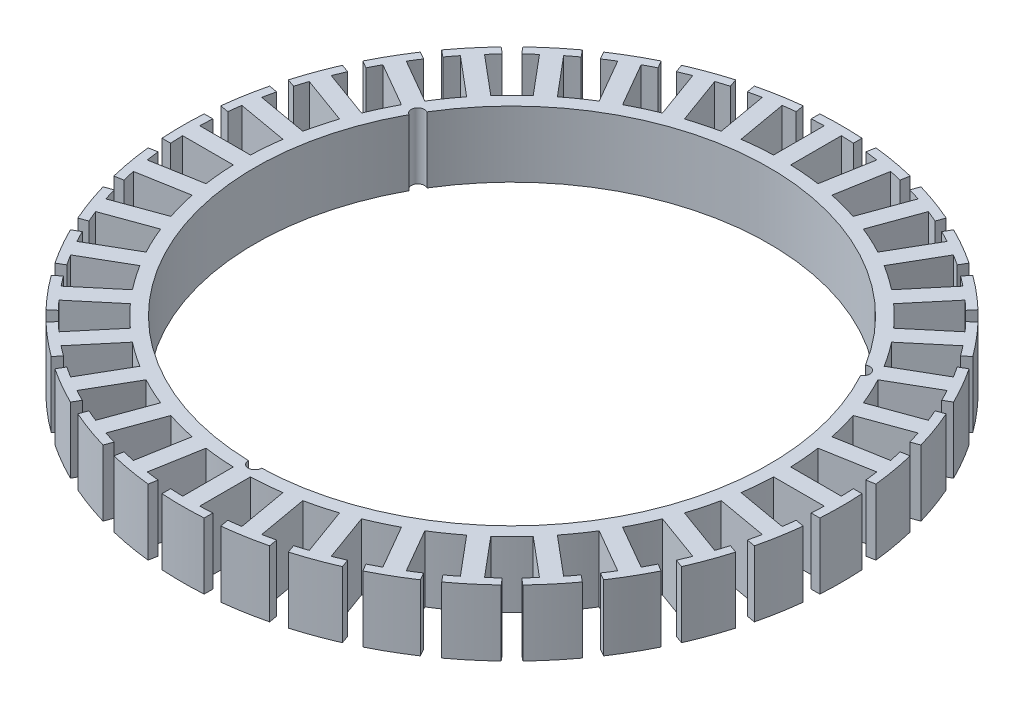
from build123d import *

# Parameters (mm, degrees)
SALIENTE_EXTRUIR3_DEPTH = 10
CROQUIS2_R              = 1
CORTAR_EXTRUIR1_DEPTH   = 10


with BuildPart() as part:
    # Croquis1 → Saliente-Extruir3 (new body)
    with BuildSketch(Plane(origin=(0, 0, 0), x_dir=(1, 0, 0), z_dir=(0, 1, 0))):
        with BuildLine():
            Line((-1.3, -40.979385061), (-1.3, -48.666202405))
            ThreePointArc((-1.3, -48.666202405), (-2.250429426, -48.631520889), (-3.2, -48.578279679))
            Line((-3.2, -48.578279679), (-3.2, -49.897494927))
            ThreePointArc((-3.2, -49.897494927), (0, -50), (3.2, -49.897494927))
            Line((3.2, -49.897494927), (3.2, -48.578279679))
            ThreePointArc((3.2, -48.578279679), (2.250429426, -48.631520889), (1.3, -48.666202405))
            Line((1.3, -48.666202405), (1.3, -40.979385061))
            ThreePointArc((1.3, -40.979385061), (2.437633052, -40.927471765), (3.573385453, -40.843982622))
            ThreePointArc((3.573385453, -40.843982622), (4.70638096, -40.728982043), (5.835745459, -40.582558753))
            Line((5.835745459, -40.582558753), (7.170547283, -48.15259607))
            ThreePointArc((7.170547283, -48.15259607), (6.228534633, -48.283481781), (5.284144931, -48.395940624))
            Line((5.284144931, -48.395940624), (5.513224255, -49.695114029))
            ThreePointArc((5.513224255, -49.695114029), (8.682408883, -49.240387651), (11.815993874, -48.583765692))
            Line((11.815993874, -48.583765692), (11.58691455, -47.284592287))
            ThreePointArc((11.58691455, -47.284592287), (10.661015326, -47.501915843), (9.731047441, -47.701110808))
            Line((9.731047441, -47.701110808), (8.396245617, -40.131073491))
            ThreePointArc((8.396245617, -40.131073491), (9.507580817, -39.882400968), (10.611580849, -39.602958878))
            ThreePointArc((10.611580849, -39.602958878), (11.707393968, -39.292962811), (12.794174745, -38.952651933))
            Line((12.794174745, -38.952651933), (15.423221115, -46.175897468))
            ThreePointArc((15.423221115, -46.175897468), (14.518247819, -46.468373512), (13.607733792, -46.743115403))
            Line((13.607733792, -46.743115403), (14.05893198, -47.982772237))
            ThreePointArc((14.05893198, -47.982772237), (17.101007166, -46.984631039), (20.072964753, -45.79384332))
            Line((20.072964753, -45.79384332), (19.621766565, -44.554186486))
            ThreePointArc((19.621766565, -44.554186486), (18.74767167, -44.928989122), (17.866421929, -45.286645096))
            Line((17.866421929, -45.286645096), (15.237375559, -38.06339956))
            ThreePointArc((15.237375559, -38.06339956), (16.288645551, -37.625523599), (17.327348731, -37.158619269))
            ThreePointArc((17.327348731, -37.158619269), (18.352683734, -36.663046788), (19.363859506, -36.139188495))
            Line((19.363859506, -36.139188495), (23.207268178, -42.796167589))
            ThreePointArc((23.207268178, -42.796167589), (22.366831392, -43.241347227), (21.517858547, -43.670024274))
            Line((21.517858547, -43.670024274), (22.177466171, -44.812498192))
            ThreePointArc((22.177466171, -44.812498192), (25, -43.301270189), (27.720028756, -41.612498192))
            Line((27.720028756, -41.612498192), (27.060421132, -40.470024274))
            ThreePointArc((27.060421132, -40.470024274), (26.264689497, -40.990917801), (25.458934228, -41.496167589))
            Line((25.458934228, -41.496167589), (21.615525556, -34.839188495))
            ThreePointArc((21.615525556, -34.839188495), (22.574788031, -34.225413735), (23.51663389, -33.585233816))
            ThreePointArc((23.51663389, -33.585233816), (24.440336492, -32.91914264), (25.345183194, -32.227654101))
            Line((25.345183194, -32.227654101), (30.286174141, -38.116097813))
            ThreePointArc((30.286174141, -38.116097813), (29.535810111, -38.700454489), (28.77417406, -39.270041555))
            Line((28.77417406, -39.270041555), (29.622149276, -40.280619065))
            ThreePointArc((29.622149276, -40.280619065), (32.139380484, -38.302222156), (34.524833712, -36.166778363))
            Line((34.524833712, -36.166778363), (33.676858496, -35.156200853))
            ThreePointArc((33.676858496, -35.156200853), (32.983668024, -35.807358186), (32.277889693, -36.444850028))
            Line((32.277889693, -36.444850028), (27.336898746, -30.556406316))
            ThreePointArc((27.336898746, -30.556406316), (28.175007001, -29.785381994), (28.991378029, -28.991378029))
            ThreePointArc((28.991378029, -28.991378029), (29.785381994, -28.175007001), (30.556406316, -27.336898746))
            Line((30.556406316, -27.336898746), (36.444850028, -32.277889693))
            ThreePointArc((36.444850028, -32.277889693), (35.807358186, -32.983668024), (35.156200853, -33.676858496))
            Line((35.156200853, -33.676858496), (36.166778363, -34.524833712))
            ThreePointArc((36.166778363, -34.524833712), (38.302222156, -32.139380484), (40.280619065, -29.622149276))
            Line((40.280619065, -29.622149276), (39.270041555, -28.77417406))
            ThreePointArc((39.270041555, -28.77417406), (38.700454489, -29.535810111), (38.116097813, -30.286174141))
            Line((38.116097813, -30.286174141), (32.227654101, -25.345183194))
            ThreePointArc((32.227654101, -25.345183194), (32.91914264, -24.440336492), (33.585233816, -23.51663389))
            ThreePointArc((33.585233816, -23.51663389), (34.225413735, -22.574788031), (34.839188495, -21.615525556))
            Line((34.839188495, -21.615525556), (41.496167589, -25.458934228))
            ThreePointArc((41.496167589, -25.458934228), (40.990917801, -26.264689497), (40.470024274, -27.060421132))
            Line((40.470024274, -27.060421132), (41.612498192, -27.720028756))
            ThreePointArc((41.612498192, -27.720028756), (43.301270189, -25), (44.812498192, -22.177466171))
            Line((44.812498192, -22.177466171), (43.670024274, -21.517858547))
            ThreePointArc((43.670024274, -21.517858547), (43.241347227, -22.366831392), (42.796167589, -23.207268178))
            Line((42.796167589, -23.207268178), (36.139188495, -19.363859506))
            ThreePointArc((36.139188495, -19.363859506), (36.663046788, -18.352683734), (37.158619269, -17.327348731))
            ThreePointArc((37.158619269, -17.327348731), (37.625523599, -16.288645551), (38.06339956, -15.237375559))
            Line((38.06339956, -15.237375559), (45.286645096, -17.866421929))
            ThreePointArc((45.286645096, -17.866421929), (44.928989122, -18.74767167), (44.554186486, -19.621766565))
            Line((44.554186486, -19.621766565), (45.79384332, -20.072964753))
            ThreePointArc((45.79384332, -20.072964753), (46.984631039, -17.101007166), (47.982772237, -14.05893198))
            Line((47.982772237, -14.05893198), (46.743115403, -13.607733792))
            ThreePointArc((46.743115403, -13.607733792), (46.468373512, -14.518247819), (46.175897468, -15.423221115))
            Line((46.175897468, -15.423221115), (38.952651933, -12.794174745))
            ThreePointArc((38.952651933, -12.794174745), (39.292962811, -11.707393968), (39.602958878, -10.611580849))
            ThreePointArc((39.602958878, -10.611580849), (39.882400968, -9.507580817), (40.131073491, -8.396245617))
            Line((40.131073491, -8.396245617), (47.701110808, -9.731047441))
            ThreePointArc((47.701110808, -9.731047441), (47.501915843, -10.661015326), (47.284592287, -11.58691455))
            Line((47.284592287, -11.58691455), (48.583765692, -11.815993874))
            ThreePointArc((48.583765692, -11.815993874), (49.240387651, -8.682408883), (49.695114029, -5.513224255))
            Line((49.695114029, -5.513224255), (48.395940624, -5.284144931))
            ThreePointArc((48.395940624, -5.284144931), (48.283481781, -6.228534633), (48.15259607, -7.170547283))
            Line((48.15259607, -7.170547283), (40.582558753, -5.835745459))
            ThreePointArc((40.582558753, -5.835745459), (40.728982043, -4.70638096), (40.843982622, -3.573385453))
            ThreePointArc((40.843982622, -3.573385453), (40.927471765, -2.437633052), (40.979385061, -1.3))
            Line((40.979385061, -1.3), (48.666202405, -1.3))
            ThreePointArc((48.666202405, -1.3), (48.631520889, -2.250429426), (48.578279679, -3.2))
            Line((48.578279679, -3.2), (49.897494927, -3.2))
            ThreePointArc((49.897494927, -3.2), (50, 0), (49.897494927, 3.2))
            Line((49.897494927, 3.2), (48.578279679, 3.2))
            ThreePointArc((48.578279679, 3.2), (48.631520889, 2.250429426), (48.666202405, 1.3))
            Line((48.666202405, 1.3), (40.979385061, 1.3))
            ThreePointArc((40.979385061, 1.3), (40.927471765, 2.437633052), (40.843982622, 3.573385453))
            ThreePointArc((40.843982622, 3.573385453), (40.728982043, 4.70638096), (40.582558753, 5.835745459))
            Line((40.582558753, 5.835745459), (48.15259607, 7.170547283))
            ThreePointArc((48.15259607, 7.170547283), (48.283481781, 6.228534633), (48.395940624, 5.284144931))
            Line((48.395940624, 5.284144931), (49.695114029, 5.513224255))
            ThreePointArc((49.695114029, 5.513224255), (49.240387651, 8.682408883), (48.583765692, 11.815993874))
            Line((48.583765692, 11.815993874), (47.284592287, 11.58691455))
            ThreePointArc((47.284592287, 11.58691455), (47.501915843, 10.661015326), (47.701110808, 9.731047441))
            Line((47.701110808, 9.731047441), (40.131073491, 8.396245617))
            ThreePointArc((40.131073491, 8.396245617), (39.882400968, 9.507580817), (39.602958878, 10.611580849))
            ThreePointArc((39.602958878, 10.611580849), (39.292962811, 11.707393968), (38.952651933, 12.794174745))
            Line((38.952651933, 12.794174745), (46.175897468, 15.423221115))
            ThreePointArc((46.175897468, 15.423221115), (46.468373512, 14.518247819), (46.743115403, 13.607733792))
            Line((46.743115403, 13.607733792), (47.982772237, 14.05893198))
            ThreePointArc((47.982772237, 14.05893198), (46.984631039, 17.101007166), (45.79384332, 20.072964753))
            Line((45.79384332, 20.072964753), (44.554186486, 19.621766565))
            ThreePointArc((44.554186486, 19.621766565), (44.928989122, 18.74767167), (45.286645096, 17.866421929))
            Line((45.286645096, 17.866421929), (38.06339956, 15.237375559))
            ThreePointArc((38.06339956, 15.237375559), (37.625523599, 16.288645551), (37.158619269, 17.327348731))
            ThreePointArc((37.158619269, 17.327348731), (36.663046788, 18.352683734), (36.139188495, 19.363859506))
            Line((36.139188495, 19.363859506), (42.796167589, 23.207268178))
            ThreePointArc((42.796167589, 23.207268178), (43.241347227, 22.366831392), (43.670024274, 21.517858547))
            Line((43.670024274, 21.517858547), (44.812498192, 22.177466171))
            ThreePointArc((44.812498192, 22.177466171), (43.301270189, 25), (41.612498192, 27.720028756))
            Line((41.612498192, 27.720028756), (40.470024274, 27.060421132))
            ThreePointArc((40.470024274, 27.060421132), (40.990917801, 26.264689497), (41.496167589, 25.458934228))
            Line((41.496167589, 25.458934228), (34.839188495, 21.615525556))
            ThreePointArc((34.839188495, 21.615525556), (34.225413735, 22.574788031), (33.585233816, 23.51663389))
            ThreePointArc((33.585233816, 23.51663389), (32.91914264, 24.440336492), (32.227654101, 25.345183194))
            Line((32.227654101, 25.345183194), (38.116097813, 30.286174141))
            ThreePointArc((38.116097813, 30.286174141), (38.700454489, 29.535810111), (39.270041555, 28.77417406))
            Line((39.270041555, 28.77417406), (40.280619065, 29.622149276))
            ThreePointArc((40.280619065, 29.622149276), (38.302222156, 32.139380484), (36.166778363, 34.524833712))
            Line((36.166778363, 34.524833712), (35.156200853, 33.676858496))
            ThreePointArc((35.156200853, 33.676858496), (35.807358186, 32.983668024), (36.444850028, 32.277889693))
            Line((36.444850028, 32.277889693), (30.556406316, 27.336898746))
            ThreePointArc((30.556406316, 27.336898746), (29.785381994, 28.175007001), (28.991378029, 28.991378029))
            ThreePointArc((28.991378029, 28.991378029), (28.175007001, 29.785381994), (27.336898746, 30.556406316))
            Line((27.336898746, 30.556406316), (32.277889693, 36.444850028))
            ThreePointArc((32.277889693, 36.444850028), (32.983668024, 35.807358186), (33.676858496, 35.156200853))
            Line((33.676858496, 35.156200853), (34.524833712, 36.166778363))
            ThreePointArc((34.524833712, 36.166778363), (32.139380484, 38.302222156), (29.622149276, 40.280619065))
            Line((29.622149276, 40.280619065), (28.77417406, 39.270041555))
            ThreePointArc((28.77417406, 39.270041555), (29.535810111, 38.700454489), (30.286174141, 38.116097813))
            Line((30.286174141, 38.116097813), (25.345183194, 32.227654101))
            ThreePointArc((25.345183194, 32.227654101), (24.440336492, 32.91914264), (23.51663389, 33.585233816))
            ThreePointArc((23.51663389, 33.585233816), (22.574788031, 34.225413735), (21.615525556, 34.839188495))
            Line((21.615525556, 34.839188495), (25.458934228, 41.496167589))
            ThreePointArc((25.458934228, 41.496167589), (26.264689497, 40.990917801), (27.060421132, 40.470024274))
            Line((27.060421132, 40.470024274), (27.720028756, 41.612498192))
            ThreePointArc((27.720028756, 41.612498192), (25, 43.301270189), (22.177466171, 44.812498192))
            Line((22.177466171, 44.812498192), (21.517858547, 43.670024274))
            ThreePointArc((21.517858547, 43.670024274), (22.366831392, 43.241347227), (23.207268178, 42.796167589))
            Line((23.207268178, 42.796167589), (19.363859506, 36.139188495))
            ThreePointArc((19.363859506, 36.139188495), (18.352683734, 36.663046788), (17.327348731, 37.158619269))
            ThreePointArc((17.327348731, 37.158619269), (16.288645551, 37.625523599), (15.237375559, 38.06339956))
            Line((15.237375559, 38.06339956), (17.866421929, 45.286645096))
            ThreePointArc((17.866421929, 45.286645096), (18.74767167, 44.928989122), (19.621766565, 44.554186486))
            Line((19.621766565, 44.554186486), (20.072964753, 45.79384332))
            ThreePointArc((20.072964753, 45.79384332), (17.101007166, 46.984631039), (14.05893198, 47.982772237))
            Line((14.05893198, 47.982772237), (13.607733792, 46.743115403))
            ThreePointArc((13.607733792, 46.743115403), (14.518247819, 46.468373512), (15.423221115, 46.175897468))
            Line((15.423221115, 46.175897468), (12.794174745, 38.952651933))
            ThreePointArc((12.794174745, 38.952651933), (11.707393968, 39.292962811), (10.611580849, 39.602958878))
            ThreePointArc((10.611580849, 39.602958878), (9.507580817, 39.882400968), (8.396245617, 40.131073491))
            Line((8.396245617, 40.131073491), (9.731047441, 47.701110808))
            ThreePointArc((9.731047441, 47.701110808), (10.661015326, 47.501915843), (11.58691455, 47.284592287))
            Line((11.58691455, 47.284592287), (11.815993874, 48.583765692))
            ThreePointArc((11.815993874, 48.583765692), (8.682408883, 49.240387651), (5.513224255, 49.695114029))
            Line((5.513224255, 49.695114029), (5.284144931, 48.395940624))
            ThreePointArc((5.284144931, 48.395940624), (6.228534633, 48.283481781), (7.170547283, 48.15259607))
            Line((7.170547283, 48.15259607), (5.835745459, 40.582558753))
            ThreePointArc((5.835745459, 40.582558753), (4.70638096, 40.728982043), (3.573385453, 40.843982622))
            ThreePointArc((3.573385453, 40.843982622), (2.437633052, 40.927471765), (1.3, 40.979385061))
            Line((1.3, 40.979385061), (1.3, 48.666202405))
            ThreePointArc((1.3, 48.666202405), (2.250429426, 48.631520889), (3.2, 48.578279679))
            Line((3.2, 48.578279679), (3.2, 49.897494927))
            ThreePointArc((3.2, 49.897494927), (0, 50), (-3.2, 49.897494927))
            Line((-3.2, 49.897494927), (-3.2, 48.578279679))
            ThreePointArc((-3.2, 48.578279679), (-2.250429426, 48.631520889), (-1.3, 48.666202405))
            Line((-1.3, 48.666202405), (-1.3, 40.979385061))
            ThreePointArc((-1.3, 40.979385061), (-2.437633052, 40.927471765), (-3.573385453, 40.843982622))
            ThreePointArc((-3.573385453, 40.843982622), (-4.70638096, 40.728982043), (-5.835745459, 40.582558753))
            Line((-5.835745459, 40.582558753), (-7.170547283, 48.15259607))
            ThreePointArc((-7.170547283, 48.15259607), (-6.228534633, 48.283481781), (-5.284144931, 48.395940624))
            Line((-5.284144931, 48.395940624), (-5.513224255, 49.695114029))
            ThreePointArc((-5.513224255, 49.695114029), (-8.682408883, 49.240387651), (-11.815993874, 48.583765692))
            Line((-11.815993874, 48.583765692), (-11.58691455, 47.284592287))
            ThreePointArc((-11.58691455, 47.284592287), (-10.661015326, 47.501915843), (-9.731047441, 47.701110808))
            Line((-9.731047441, 47.701110808), (-8.396245617, 40.131073491))
            ThreePointArc((-8.396245617, 40.131073491), (-9.507580817, 39.882400968), (-10.611580849, 39.602958878))
            ThreePointArc((-10.611580849, 39.602958878), (-11.707393968, 39.292962811), (-12.794174745, 38.952651933))
            Line((-12.794174745, 38.952651933), (-15.423221115, 46.175897468))
            ThreePointArc((-15.423221115, 46.175897468), (-14.518247819, 46.468373512), (-13.607733792, 46.743115403))
            Line((-13.607733792, 46.743115403), (-14.05893198, 47.982772237))
            ThreePointArc((-14.05893198, 47.982772237), (-17.101007166, 46.984631039), (-20.072964753, 45.79384332))
            Line((-20.072964753, 45.79384332), (-19.621766565, 44.554186486))
            ThreePointArc((-19.621766565, 44.554186486), (-18.74767167, 44.928989122), (-17.866421929, 45.286645096))
            Line((-17.866421929, 45.286645096), (-15.237375559, 38.06339956))
            ThreePointArc((-15.237375559, 38.06339956), (-16.288645551, 37.625523599), (-17.327348731, 37.158619269))
            ThreePointArc((-17.327348731, 37.158619269), (-18.352683734, 36.663046788), (-19.363859506, 36.139188495))
            Line((-19.363859506, 36.139188495), (-23.207268178, 42.796167589))
            ThreePointArc((-23.207268178, 42.796167589), (-22.366831392, 43.241347227), (-21.517858547, 43.670024274))
            Line((-21.517858547, 43.670024274), (-22.177466171, 44.812498192))
            ThreePointArc((-22.177466171, 44.812498192), (-25, 43.301270189), (-27.720028756, 41.612498192))
            Line((-27.720028756, 41.612498192), (-27.060421132, 40.470024274))
            ThreePointArc((-27.060421132, 40.470024274), (-26.264689497, 40.990917801), (-25.458934228, 41.496167589))
            Line((-25.458934228, 41.496167589), (-21.615525556, 34.839188495))
            ThreePointArc((-21.615525556, 34.839188495), (-22.574788031, 34.225413735), (-23.51663389, 33.585233816))
            ThreePointArc((-23.51663389, 33.585233816), (-24.440336492, 32.91914264), (-25.345183194, 32.227654101))
            Line((-25.345183194, 32.227654101), (-30.286174141, 38.116097813))
            ThreePointArc((-30.286174141, 38.116097813), (-29.535810111, 38.700454489), (-28.77417406, 39.270041555))
            Line((-28.77417406, 39.270041555), (-29.622149276, 40.280619065))
            ThreePointArc((-29.622149276, 40.280619065), (-32.139380484, 38.302222156), (-34.524833712, 36.166778363))
            Line((-34.524833712, 36.166778363), (-33.676858496, 35.156200853))
            ThreePointArc((-33.676858496, 35.156200853), (-32.983668024, 35.807358186), (-32.277889693, 36.444850028))
            Line((-32.277889693, 36.444850028), (-27.336898746, 30.556406316))
            ThreePointArc((-27.336898746, 30.556406316), (-28.175007001, 29.785381994), (-28.991378029, 28.991378029))
            ThreePointArc((-28.991378029, 28.991378029), (-29.785381994, 28.175007001), (-30.556406316, 27.336898746))
            Line((-30.556406316, 27.336898746), (-36.444850028, 32.277889693))
            ThreePointArc((-36.444850028, 32.277889693), (-35.807358186, 32.983668024), (-35.156200853, 33.676858496))
            Line((-35.156200853, 33.676858496), (-36.166778363, 34.524833712))
            ThreePointArc((-36.166778363, 34.524833712), (-38.302222156, 32.139380484), (-40.280619065, 29.622149276))
            Line((-40.280619065, 29.622149276), (-39.270041555, 28.77417406))
            ThreePointArc((-39.270041555, 28.77417406), (-38.700454489, 29.535810111), (-38.116097813, 30.286174141))
            Line((-38.116097813, 30.286174141), (-32.227654101, 25.345183194))
            ThreePointArc((-32.227654101, 25.345183194), (-32.91914264, 24.440336492), (-33.585233816, 23.51663389))
            ThreePointArc((-33.585233816, 23.51663389), (-34.225413735, 22.574788031), (-34.839188495, 21.615525556))
            Line((-34.839188495, 21.615525556), (-41.496167589, 25.458934228))
            ThreePointArc((-41.496167589, 25.458934228), (-40.990917801, 26.264689497), (-40.470024274, 27.060421132))
            Line((-40.470024274, 27.060421132), (-41.612498192, 27.720028756))
            ThreePointArc((-41.612498192, 27.720028756), (-43.301270189, 25), (-44.812498192, 22.177466171))
            Line((-44.812498192, 22.177466171), (-43.670024274, 21.517858547))
            ThreePointArc((-43.670024274, 21.517858547), (-43.241347227, 22.366831392), (-42.796167589, 23.207268178))
            Line((-42.796167589, 23.207268178), (-36.139188495, 19.363859506))
            ThreePointArc((-36.139188495, 19.363859506), (-36.663046788, 18.352683734), (-37.158619269, 17.327348731))
            ThreePointArc((-37.158619269, 17.327348731), (-37.625523599, 16.288645551), (-38.06339956, 15.237375559))
            Line((-38.06339956, 15.237375559), (-45.286645096, 17.866421929))
            ThreePointArc((-45.286645096, 17.866421929), (-44.928989122, 18.74767167), (-44.554186486, 19.621766565))
            Line((-44.554186486, 19.621766565), (-45.79384332, 20.072964753))
            ThreePointArc((-45.79384332, 20.072964753), (-46.984631039, 17.101007166), (-47.982772237, 14.05893198))
            Line((-47.982772237, 14.05893198), (-46.743115403, 13.607733792))
            ThreePointArc((-46.743115403, 13.607733792), (-46.468373512, 14.518247819), (-46.175897468, 15.423221115))
            Line((-46.175897468, 15.423221115), (-38.952651933, 12.794174745))
            ThreePointArc((-38.952651933, 12.794174745), (-39.292962811, 11.707393968), (-39.602958878, 10.611580849))
            ThreePointArc((-39.602958878, 10.611580849), (-39.882400968, 9.507580817), (-40.131073491, 8.396245617))
            Line((-40.131073491, 8.396245617), (-47.701110808, 9.731047441))
            ThreePointArc((-47.701110808, 9.731047441), (-47.501915843, 10.661015326), (-47.284592287, 11.58691455))
            Line((-47.284592287, 11.58691455), (-48.583765692, 11.815993874))
            ThreePointArc((-48.583765692, 11.815993874), (-49.240387651, 8.682408883), (-49.695114029, 5.513224255))
            Line((-49.695114029, 5.513224255), (-48.395940624, 5.284144931))
            ThreePointArc((-48.395940624, 5.284144931), (-48.283481781, 6.228534633), (-48.15259607, 7.170547283))
            Line((-48.15259607, 7.170547283), (-40.582558753, 5.835745459))
            ThreePointArc((-40.582558753, 5.835745459), (-40.728982043, 4.70638096), (-40.843982622, 3.573385453))
            ThreePointArc((-40.843982622, 3.573385453), (-40.927471765, 2.437633052), (-40.979385061, 1.3))
            Line((-40.979385061, 1.3), (-48.666202405, 1.3))
            ThreePointArc((-48.666202405, 1.3), (-48.631520889, 2.250429426), (-48.578279679, 3.2))
            Line((-48.578279679, 3.2), (-49.897494927, 3.2))
            ThreePointArc((-49.897494927, 3.2), (-50, 0), (-49.897494927, -3.2))
            Line((-49.897494927, -3.2), (-48.578279679, -3.2))
            ThreePointArc((-48.578279679, -3.2), (-48.631520889, -2.250429426), (-48.666202405, -1.3))
            Line((-48.666202405, -1.3), (-40.979385061, -1.3))
            ThreePointArc((-40.979385061, -1.3), (-40.927471765, -2.437633052), (-40.843982622, -3.573385453))
            ThreePointArc((-40.843982622, -3.573385453), (-40.728982043, -4.70638096), (-40.582558753, -5.835745459))
            Line((-40.582558753, -5.835745459), (-48.15259607, -7.170547283))
            ThreePointArc((-48.15259607, -7.170547283), (-48.283481781, -6.228534633), (-48.395940624, -5.284144931))
            Line((-48.395940624, -5.284144931), (-49.695114029, -5.513224255))
            ThreePointArc((-49.695114029, -5.513224255), (-49.240387651, -8.682408883), (-48.583765692, -11.815993874))
            Line((-48.583765692, -11.815993874), (-47.284592287, -11.58691455))
            ThreePointArc((-47.284592287, -11.58691455), (-47.501915843, -10.661015326), (-47.701110808, -9.731047441))
            Line((-47.701110808, -9.731047441), (-40.131073491, -8.396245617))
            ThreePointArc((-40.131073491, -8.396245617), (-39.882400968, -9.507580817), (-39.602958878, -10.611580849))
            ThreePointArc((-39.602958878, -10.611580849), (-39.292962811, -11.707393968), (-38.952651933, -12.794174745))
            Line((-38.952651933, -12.794174745), (-46.175897468, -15.423221115))
            ThreePointArc((-46.175897468, -15.423221115), (-46.468373512, -14.518247819), (-46.743115403, -13.607733792))
            Line((-46.743115403, -13.607733792), (-47.982772237, -14.05893198))
            ThreePointArc((-47.982772237, -14.05893198), (-46.984631039, -17.101007166), (-45.79384332, -20.072964753))
            Line((-45.79384332, -20.072964753), (-44.554186486, -19.621766565))
            ThreePointArc((-44.554186486, -19.621766565), (-44.928989122, -18.74767167), (-45.286645096, -17.866421929))
            Line((-45.286645096, -17.866421929), (-38.06339956, -15.237375559))
            ThreePointArc((-38.06339956, -15.237375559), (-37.625523599, -16.288645551), (-37.158619269, -17.327348731))
            ThreePointArc((-37.158619269, -17.327348731), (-36.663046788, -18.352683734), (-36.139188495, -19.363859506))
            Line((-36.139188495, -19.363859506), (-42.796167589, -23.207268178))
            ThreePointArc((-42.796167589, -23.207268178), (-43.241347227, -22.366831392), (-43.670024274, -21.517858547))
            Line((-43.670024274, -21.517858547), (-44.812498192, -22.177466171))
            ThreePointArc((-44.812498192, -22.177466171), (-43.301270189, -25), (-41.612498192, -27.720028756))
            Line((-41.612498192, -27.720028756), (-40.470024274, -27.060421132))
            ThreePointArc((-40.470024274, -27.060421132), (-40.990917801, -26.264689497), (-41.496167589, -25.458934228))
            Line((-41.496167589, -25.458934228), (-34.839188495, -21.615525556))
            ThreePointArc((-34.839188495, -21.615525556), (-34.225413735, -22.574788031), (-33.585233816, -23.51663389))
            ThreePointArc((-33.585233816, -23.51663389), (-32.91914264, -24.440336492), (-32.227654101, -25.345183194))
            Line((-32.227654101, -25.345183194), (-38.116097813, -30.286174141))
            ThreePointArc((-38.116097813, -30.286174141), (-38.700454489, -29.535810111), (-39.270041555, -28.77417406))
            Line((-39.270041555, -28.77417406), (-40.280619065, -29.622149276))
            ThreePointArc((-40.280619065, -29.622149276), (-38.302222156, -32.139380484), (-36.166778363, -34.524833712))
            Line((-36.166778363, -34.524833712), (-35.156200853, -33.676858496))
            ThreePointArc((-35.156200853, -33.676858496), (-35.807358186, -32.983668024), (-36.444850028, -32.277889693))
            Line((-36.444850028, -32.277889693), (-30.556406316, -27.336898746))
            ThreePointArc((-30.556406316, -27.336898746), (-29.785381994, -28.175007001), (-28.991378029, -28.991378029))
            ThreePointArc((-28.991378029, -28.991378029), (-28.175007001, -29.785381994), (-27.336898746, -30.556406316))
            Line((-27.336898746, -30.556406316), (-32.277889693, -36.444850028))
            ThreePointArc((-32.277889693, -36.444850028), (-32.983668024, -35.807358186), (-33.676858496, -35.156200853))
            Line((-33.676858496, -35.156200853), (-34.524833712, -36.166778363))
            ThreePointArc((-34.524833712, -36.166778363), (-32.139380484, -38.302222156), (-29.622149276, -40.280619065))
            Line((-29.622149276, -40.280619065), (-28.77417406, -39.270041555))
            ThreePointArc((-28.77417406, -39.270041555), (-29.535810111, -38.700454489), (-30.286174141, -38.116097813))
            Line((-30.286174141, -38.116097813), (-25.345183194, -32.227654101))
            ThreePointArc((-25.345183194, -32.227654101), (-24.440336492, -32.91914264), (-23.51663389, -33.585233816))
            ThreePointArc((-23.51663389, -33.585233816), (-22.574788031, -34.225413735), (-21.615525556, -34.839188495))
            Line((-21.615525556, -34.839188495), (-25.458934228, -41.496167589))
            ThreePointArc((-25.458934228, -41.496167589), (-26.264689497, -40.990917801), (-27.060421132, -40.470024274))
            Line((-27.060421132, -40.470024274), (-27.720028756, -41.612498192))
            ThreePointArc((-27.720028756, -41.612498192), (-25, -43.301270189), (-22.177466171, -44.812498192))
            Line((-22.177466171, -44.812498192), (-21.517858547, -43.670024274))
            ThreePointArc((-21.517858547, -43.670024274), (-22.366831392, -43.241347227), (-23.207268178, -42.796167589))
            Line((-23.207268178, -42.796167589), (-19.363859506, -36.139188495))
            ThreePointArc((-19.363859506, -36.139188495), (-18.352683734, -36.663046788), (-17.327348731, -37.158619269))
            ThreePointArc((-17.327348731, -37.158619269), (-16.288645551, -37.625523599), (-15.237375559, -38.06339956))
            Line((-15.237375559, -38.06339956), (-17.866421929, -45.286645096))
            ThreePointArc((-17.866421929, -45.286645096), (-18.74767167, -44.928989122), (-19.621766565, -44.554186486))
            Line((-19.621766565, -44.554186486), (-20.072964753, -45.79384332))
            ThreePointArc((-20.072964753, -45.79384332), (-17.101007166, -46.984631039), (-14.05893198, -47.982772237))
            Line((-14.05893198, -47.982772237), (-13.607733792, -46.743115403))
            ThreePointArc((-13.607733792, -46.743115403), (-14.518247819, -46.468373512), (-15.423221115, -46.175897468))
            Line((-15.423221115, -46.175897468), (-12.794174745, -38.952651933))
            ThreePointArc((-12.794174745, -38.952651933), (-11.707393968, -39.292962811), (-10.611580849, -39.602958878))
            ThreePointArc((-10.611580849, -39.602958878), (-9.507580817, -39.882400968), (-8.396245617, -40.131073491))
            Line((-8.396245617, -40.131073491), (-9.731047441, -47.701110808))
            ThreePointArc((-9.731047441, -47.701110808), (-10.661015326, -47.501915843), (-11.58691455, -47.284592287))
            Line((-11.58691455, -47.284592287), (-11.815993874, -48.583765692))
            ThreePointArc((-11.815993874, -48.583765692), (-8.682408883, -49.240387651), (-5.513224255, -49.695114029))
            Line((-5.513224255, -49.695114029), (-5.284144931, -48.395940624))
            ThreePointArc((-5.284144931, -48.395940624), (-6.228534633, -48.283481781), (-7.170547283, -48.15259607))
            Line((-7.170547283, -48.15259607), (-5.835745459, -40.582558753))
            ThreePointArc((-5.835745459, -40.582558753), (-4.70638096, -40.728982043), (-3.573385453, -40.843982622))
            ThreePointArc((-3.573385453, -40.843982622), (-2.437633052, -40.927471765), (-1.3, -40.979385061))
        make_face()
        with BuildLine():
            ThreePointArc((-3.399073967, -38.851593226), (0, -39), (3.399073967, -38.851593226))
            ThreePointArc((3.399073967, -38.851593226), (6.772278929, -38.407502367), (10.093942759, -37.671107225))
            ThreePointArc((10.093942759, -37.671107225), (13.33878559, -36.648012211), (16.482112208, -35.346003694))
            ThreePointArc((16.482112208, -35.346003694), (19.5, -33.774990748), (22.369481018, -31.946929727))
            ThreePointArc((22.369481018, -31.946929727), (25.068716778, -29.875733282), (27.577164466, -27.577164466))
            ThreePointArc((27.577164466, -27.577164466), (29.875733282, -25.068716778), (31.946929727, -22.369481018))
            ThreePointArc((31.946929727, -22.369481018), (33.774990748, -19.5), (35.346003694, -16.482112208))
            ThreePointArc((35.346003694, -16.482112208), (36.648012211, -13.33878559), (37.671107225, -10.093942759))
            ThreePointArc((37.671107225, -10.093942759), (38.407502367, -6.772278929), (38.851593226, -3.399073967))
            ThreePointArc((38.851593226, -3.399073967), (39, 0), (38.851593226, 3.399073967))
            ThreePointArc((38.851593226, 3.399073967), (38.407502367, 6.772278929), (37.671107225, 10.093942759))
            ThreePointArc((37.671107225, 10.093942759), (36.648012211, 13.33878559), (35.346003694, 16.482112208))
            ThreePointArc((35.346003694, 16.482112208), (33.774990748, 19.5), (31.946929727, 22.369481018))
            ThreePointArc((31.946929727, 22.369481018), (29.875733282, 25.068716778), (27.577164466, 27.577164466))
            ThreePointArc((27.577164466, 27.577164466), (25.068716778, 29.875733282), (22.369481018, 31.946929727))
            ThreePointArc((22.369481018, 31.946929727), (19.5, 33.774990748), (16.482112208, 35.346003694))
            ThreePointArc((16.482112208, 35.346003694), (13.33878559, 36.648012211), (10.093942759, 37.671107225))
            ThreePointArc((10.093942759, 37.671107225), (6.772278929, 38.407502367), (3.399073967, 38.851593226))
            ThreePointArc((3.399073967, 38.851593226), (0, 39), (-3.399073967, 38.851593226))
            ThreePointArc((-3.399073967, 38.851593226), (-6.772278929, 38.407502367), (-10.093942759, 37.671107225))
            ThreePointArc((-10.093942759, 37.671107225), (-13.33878559, 36.648012211), (-16.482112208, 35.346003694))
            ThreePointArc((-16.482112208, 35.346003694), (-19.5, 33.774990748), (-22.369481018, 31.946929727))
            ThreePointArc((-22.369481018, 31.946929727), (-25.068716778, 29.875733282), (-27.577164466, 27.577164466))
            ThreePointArc((-27.577164466, 27.577164466), (-29.875733282, 25.068716778), (-31.946929727, 22.369481018))
            ThreePointArc((-31.946929727, 22.369481018), (-33.774990748, 19.5), (-35.346003694, 16.482112208))
            ThreePointArc((-35.346003694, 16.482112208), (-36.648012211, 13.33878559), (-37.671107225, 10.093942759))
            ThreePointArc((-37.671107225, 10.093942759), (-38.407502367, 6.772278929), (-38.851593226, 3.399073967))
            ThreePointArc((-38.851593226, 3.399073967), (-39, 0), (-38.851593226, -3.399073967))
            ThreePointArc((-38.851593226, -3.399073967), (-38.407502367, -6.772278929), (-37.671107225, -10.093942759))
            ThreePointArc((-37.671107225, -10.093942759), (-36.648012211, -13.33878559), (-35.346003694, -16.482112208))
            ThreePointArc((-35.346003694, -16.482112208), (-33.774990748, -19.5), (-31.946929727, -22.369481018))
            ThreePointArc((-31.946929727, -22.369481018), (-29.875733282, -25.068716778), (-27.577164466, -27.577164466))
            ThreePointArc((-27.577164466, -27.577164466), (-25.068716778, -29.875733282), (-22.369481018, -31.946929727))
            ThreePointArc((-22.369481018, -31.946929727), (-19.5, -33.774990748), (-16.482112208, -35.346003694))
            ThreePointArc((-16.482112208, -35.346003694), (-13.33878559, -36.648012211), (-10.093942759, -37.671107225))
            ThreePointArc((-10.093942759, -37.671107225), (-6.772278929, -38.407502367), (-3.399073967, -38.851593226))
        make_face(mode=Mode.SUBTRACT)
    extrude(amount=SALIENTE_EXTRUIR3_DEPTH)

    # Croquis2 → Cortar-Extruir1 (cut)
    with BuildSketch(Plane(origin=(0, 0, 0), x_dir=(-1, 0, 0), z_dir=(0, -1, 0))):
        with Locations((0, -39)):
            Circle(CROQUIS2_R)
        with Locations((-33.774990748, 19.5)):
            Circle(CROQUIS2_R)
        with Locations((33.774990748, 19.5)):
            Circle(CROQUIS2_R)
    extrude(amount=-CORTAR_EXTRUIR1_DEPTH, mode=Mode.SUBTRACT)


solid = part.part
